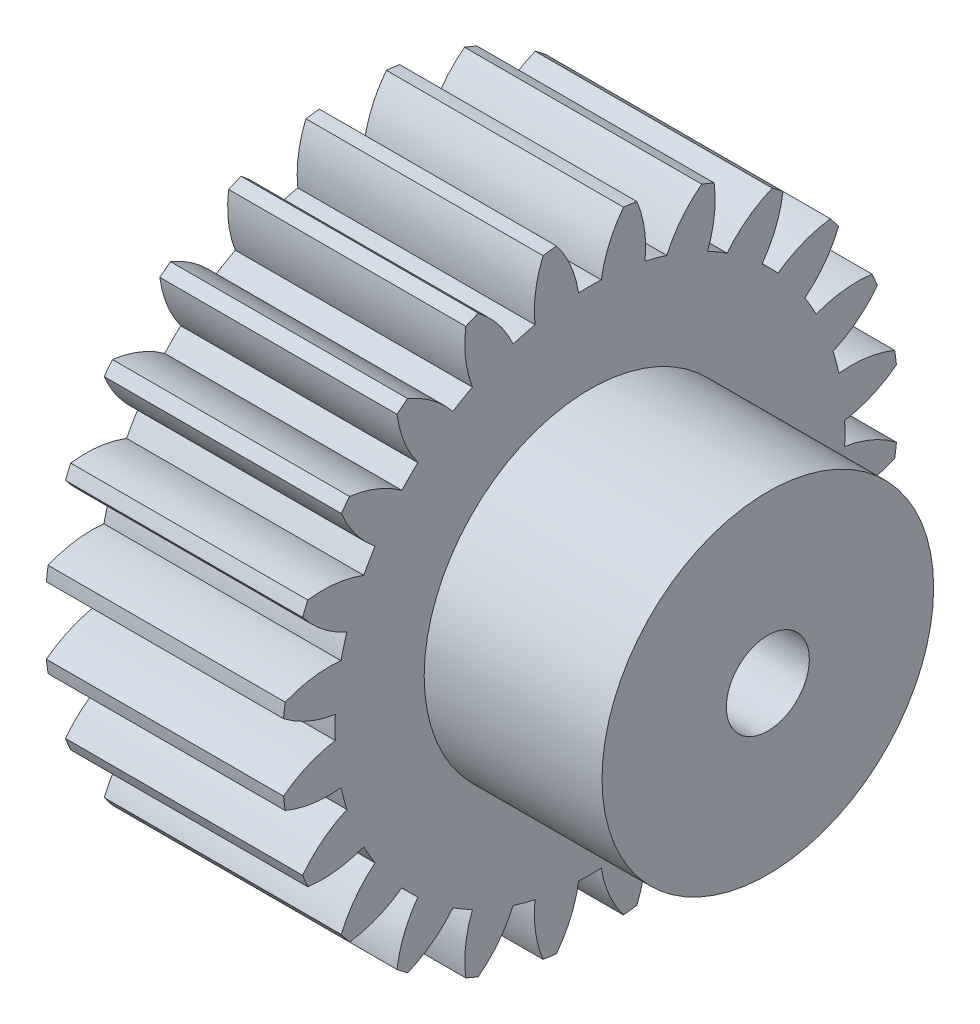
from build123d import *

# Parameters (mm, degrees)
BASPROSKE_W             = 20
BASPROSKE_H             = 26
TOOTHCUT_DEPTH          = 42.856899073
TEETHCUTS_COUNT         = 24
TEETHCUTS_ANGLE         = 345
BORSKE_R                = 3.5
BORE_DEPTH              = 50.0000508
BOSS_EXTRU_1_START      = 15
ESQUISSE2_R             = 13.982903341
ESQUISSE2_R_2           = 3.5
BOSS_EXTRU_1_DEPTH      = 15
ESQUISSE3_R             = 2
ENL_V_MAT_EXTRU_1_DEPTH = 15


with BuildPart() as part:
    # BasProSke → Base-Revolve (revolve)
    with BuildSketch(Plane(origin=(0, 0, 0), x_dir=(1, 0, 0), z_dir=(0, 1, 0)), mode=Mode.PRIVATE) as base_revolve_sk:
        with Locations((10, 13)):
            Rectangle(BASPROSKE_W, BASPROSKE_H)
    revolve(base_revolve_sk.sketch.rotate(Axis((-10, 0, 0), (1, 0, 0)), 180), axis=Axis((-10, 0, 0), (1, 0, 0)))

    # TooCutSke → ToothCut (cut, through all)
    with BuildSketch(Plane(origin=(0, 0, 0), x_dir=(0, 0, -1), z_dir=(1, 0, 0))):
        with BuildLine():
            ThreePointArc((0.952932849, 21.477870471), (0, 21.499), (-0.952932849, 21.477870471))
            ThreePointArc((-0.952932849, 21.477870471), (-1.621910648, 23.79336664), (-2.846540061, 25.86926081))
            ThreePointArc((-2.846540061, 25.86926081), (0, 26.0254), (2.846540061, 25.86926081))
            ThreePointArc((2.846540061, 25.86926081), (1.621910648, 23.79336664), (0.952932849, 21.477870471))
        make_face()
    toothcut = extrude(amount=TOOTHCUT_DEPTH, mode=Mode.SUBTRACT)

    # TeethCuts: ToothCut ×24 about axis
    teethcuts_axis = Axis((-10, 0, 0), (1, 0, 0))
    for i in range(1, TEETHCUTS_COUNT):
        add(toothcut.rotate(teethcuts_axis, i * TEETHCUTS_ANGLE / (TEETHCUTS_COUNT - 1)), mode=Mode.SUBTRACT)

    # BorSke → Bore (cut, symmetric)
    with BuildSketch(Plane(origin=(0, 0, 0), x_dir=(0, 0, -1), z_dir=(1, 0, 0))):
        with Locations(Location((0, 0, 0), (0, 0, 180))):
            Circle(BORSKE_R)
    extrude(amount=BORE_DEPTH, both=True, mode=Mode.SUBTRACT)

    # Esquisse2 → Boss.-Extru.1 (add)
    with BuildSketch(Plane(origin=(20, 0, 0), x_dir=(0, 0, -1), z_dir=(1, 0, 0)).offset(BOSS_EXTRU_1_START)):
        with Locations(Location((0, 0, 0), (0, 0, 180))):
            Circle(ESQUISSE2_R)
        Circle(ESQUISSE2_R_2, mode=Mode.SUBTRACT)
    extrude(amount=-BOSS_EXTRU_1_DEPTH)

    # Esquisse3 → Enlèv. mat.-Extru.1 (cut)
    with BuildSketch(Plane(origin=(0, 0, 0), x_dir=(1, 0, 0), z_dir=(0, 1, 0))):
        with Locations(Location((27.5, 1.220617441, 0), (0, 0, 270))):
            Circle(ESQUISSE3_R)
    extrude(amount=-ENL_V_MAT_EXTRU_1_DEPTH, mode=Mode.SUBTRACT)


solid = part.part
